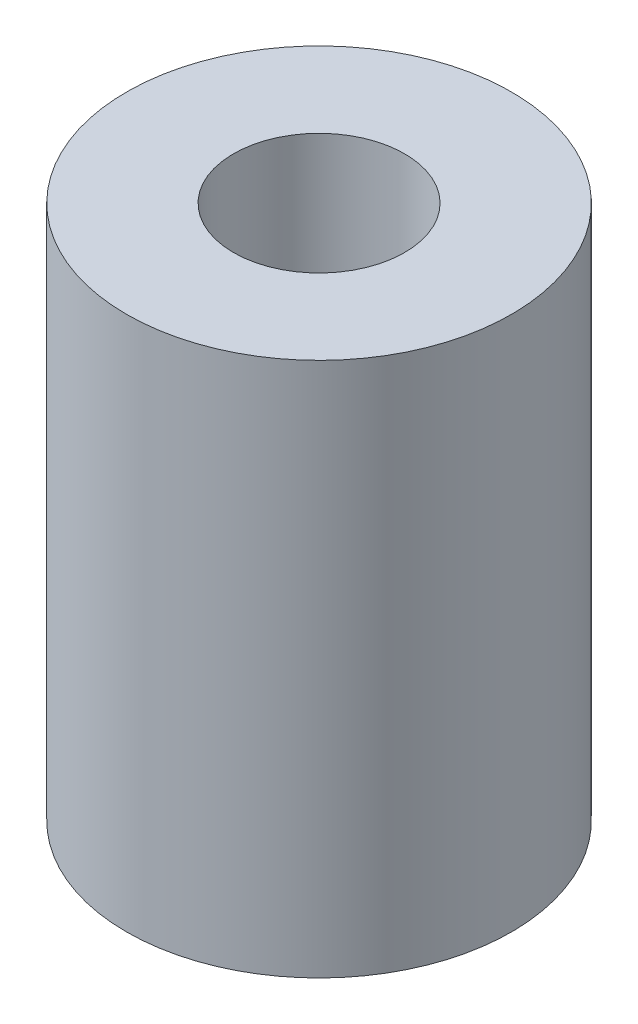
from build123d import *

# Parameters (mm, degrees)
SKETCH_1_R          = 9
SKETCH_1_R_2        = 2.5
EXTRUDE_1_DEPTH     = 25
SKETCH_2_R          = 4
CUT_EXTRUDE_1_DEPTH = 10


with BuildPart() as part:
    # Эскиз1 → Бобышка-Вытянуть1 (new body)
    with BuildSketch(Plane(origin=(0, 0, 0), x_dir=(1, 0, 0), z_dir=(0, 1, 0))):
        with Locations(Location((0, 0, 0), (0, 0, 270))):
            Circle(SKETCH_1_R)
        with Locations(Location((0, 0, 0), (0, 0, 270))):
            Circle(SKETCH_1_R_2, mode=Mode.SUBTRACT)
    extrude(amount=EXTRUDE_1_DEPTH)

    # Эскиз2 → Вырез-Вытянуть1 (cut)
    with BuildSketch(Plane(origin=(0, 25, 0), x_dir=(1, 0, 0), z_dir=(0, 1, 0))):
        with Locations(Location((0, 0, 0), (0, 0, 270))):
            Circle(SKETCH_2_R)
    extrude(amount=-CUT_EXTRUDE_1_DEPTH, mode=Mode.SUBTRACT)


solid = part.part
